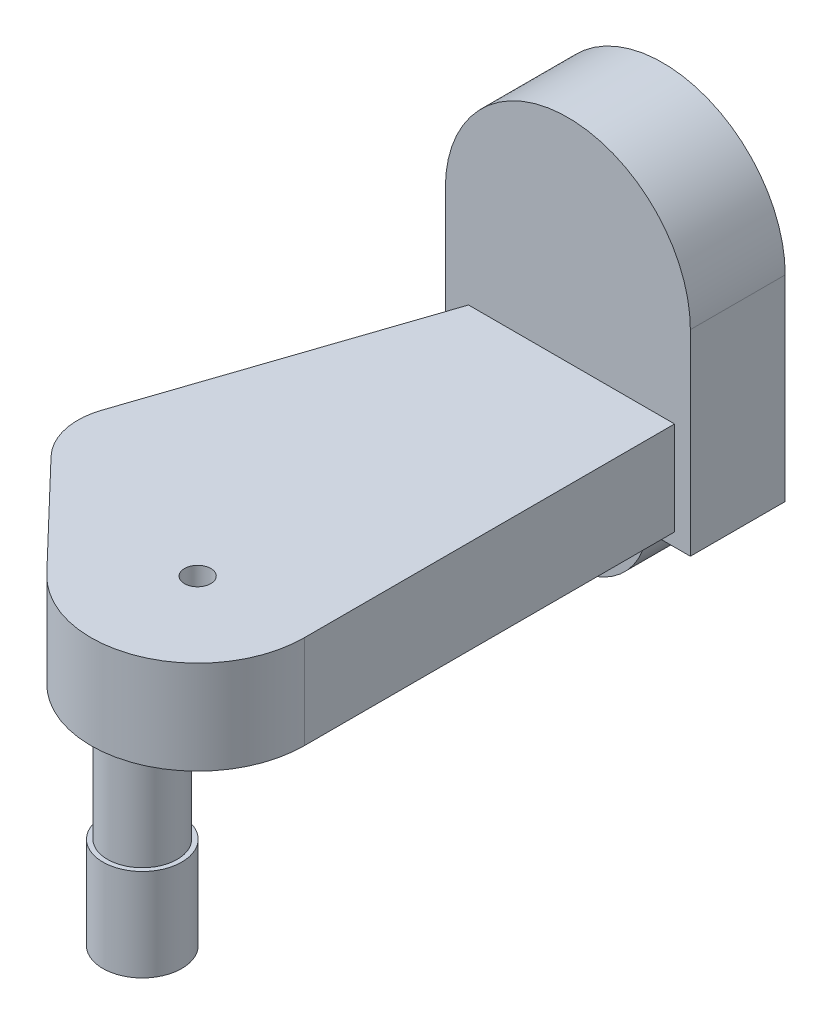
from build123d import *

# Parameters (mm, degrees)
EXTRUSION1_DEPTH        = 64
COQUE14_T               = 8
EXTRUSION2_DEPTH        = 71
ENL_V_MAT_EXTRU_1_DEPTH = 65
ESQUISSE8_R             = 26.5
EXTRUSION3_DEPTH        = 84
ESQUISSE9_R             = 34.5
EXTRUSION4_DEPTH        = 14
ESQUISSE10_R            = 26.5
EXTRUSION5_DEPTH        = 82
ESQUISSE11_R            = 30
EXTRUSION6_DEPTH        = 70
ESQUISSE12_R            = 25
EXTRUSION7_DEPTH        = 110
ESQUISSE13_R            = 17.5
EXTRUSION8_DEPTH        = 50
ESQUISSE14_R            = 10
ENL_V_MAT_EXTRU_2_DEPTH = 523.264300905


with BuildPart() as part:
    # Esquisse1 → Extrusion1 (new body)
    with BuildSketch(Plane.XY):
        with BuildLine():
            Line((53, -141), (85, -141))
            Line((85, -141), (85, 0))
            ThreePointArc((85, 0), (0, 85), (-85, 0))
            Line((-85, 0), (-85, -141))
            Line((-85, -141), (-53, -141))
            ThreePointArc((-53, -141), (0, -194), (53, -141))
        make_face()
    extrude(amount=EXTRUSION1_DEPTH)

    # Coque14
    coque14_openings = [part.faces().sort_by_distance(p)[0] for p in [
        (0, -50.38495727, 0),
    ]]
    offset(amount=COQUE14_T, openings=coque14_openings, kind=Kind.INTERSECTION)

    # Esquisse2 → Extrusion2 (add)
    with BuildSketch(Plane(origin=(0, -139, 0), x_dir=(-1, 0, 0), z_dir=(0, 1, 0))):
        with BuildLine():
            Line((-81, 72), (-81, 353))
            ThreePointArc((-81, 353), (-30.212730552, 428.154447058), (58.461504015, 409.0647175))
            Line((58.461504015, 409.0647175), (134.365601194, 329.915693302))
            ThreePointArc((134.365601194, 329.915693302), (146.818305394, 306.69624557), (145.44507462, 280.384141281))
            Line((145.44507462, 280.384141281), (75.381729126, 72))
            Line((75.381729126, 72), (-81, 72))
        make_face()
    extrude(amount=EXTRUSION2_DEPTH)

    # Esquisse4 → Enlèv. mat.-Extru.1 (cut)
    with BuildSketch(Plane(origin=(-53, -141, 64), x_dir=(1, 0, 0), z_dir=(0, -1, 0))):
        Polygon((101.5, 8), (101.5, 173), (53, 188), (4.5, 173), (4.5, 8), align=None)
    extrude(amount=-ENL_V_MAT_EXTRU_1_DEPTH, mode=Mode.SUBTRACT)

    # Esquisse8 → Extrusion3 (add)
    with BuildSketch(Plane.XZ.offset(139)):
        with Locations(Location((-99, 296, 0), (0, 0, 90))):
            Circle(ESQUISSE8_R)
    extrude(amount=EXTRUSION3_DEPTH)

    # Esquisse9 → Extrusion4 (add)
    with BuildSketch(Plane.XZ.offset(223)):
        with Locations(Location((-99, 296, 0), (0, 0, 270))):
            Circle(ESQUISSE9_R)
    extrude(amount=EXTRUSION4_DEPTH)

    # Esquisse10 → Extrusion5 (add)
    with BuildSketch(Plane.XZ.offset(237)):
        with Locations(Location((-99, 296, 0), (0, 0, 90))):
            Circle(ESQUISSE10_R)
    extrude(amount=EXTRUSION5_DEPTH)

    # Esquisse11 → Extrusion6 (add)
    with BuildSketch(Plane.XZ.offset(319)):
        with Locations(Location((-99, 296, 0), (0, 0, 270))):
            Circle(ESQUISSE11_R)
    extrude(amount=EXTRUSION6_DEPTH)

    # Esquisse12 → Extrusion7 (add)
    with BuildSketch(Plane.XY.offset(72)):
        with Locations((0, -141)):
            Circle(ESQUISSE12_R)
    extrude(amount=EXTRUSION7_DEPTH)

    # Esquisse13 → Extrusion8 (add)
    with BuildSketch(Plane.XY.offset(182)):
        with Locations((0, -141)):
            Circle(ESQUISSE13_R)
    extrude(amount=EXTRUSION8_DEPTH)

    # Esquisse14 → Enlèv. mat.-Extru.2 (cut, through all)
    with BuildSketch(Plane.XZ.offset(139)):
        with Locations(Location((0, 353, 0), (0, 0, 270))):
            Circle(ESQUISSE14_R)
    extrude(amount=-ENL_V_MAT_EXTRU_2_DEPTH, mode=Mode.SUBTRACT)


solid = part.part
